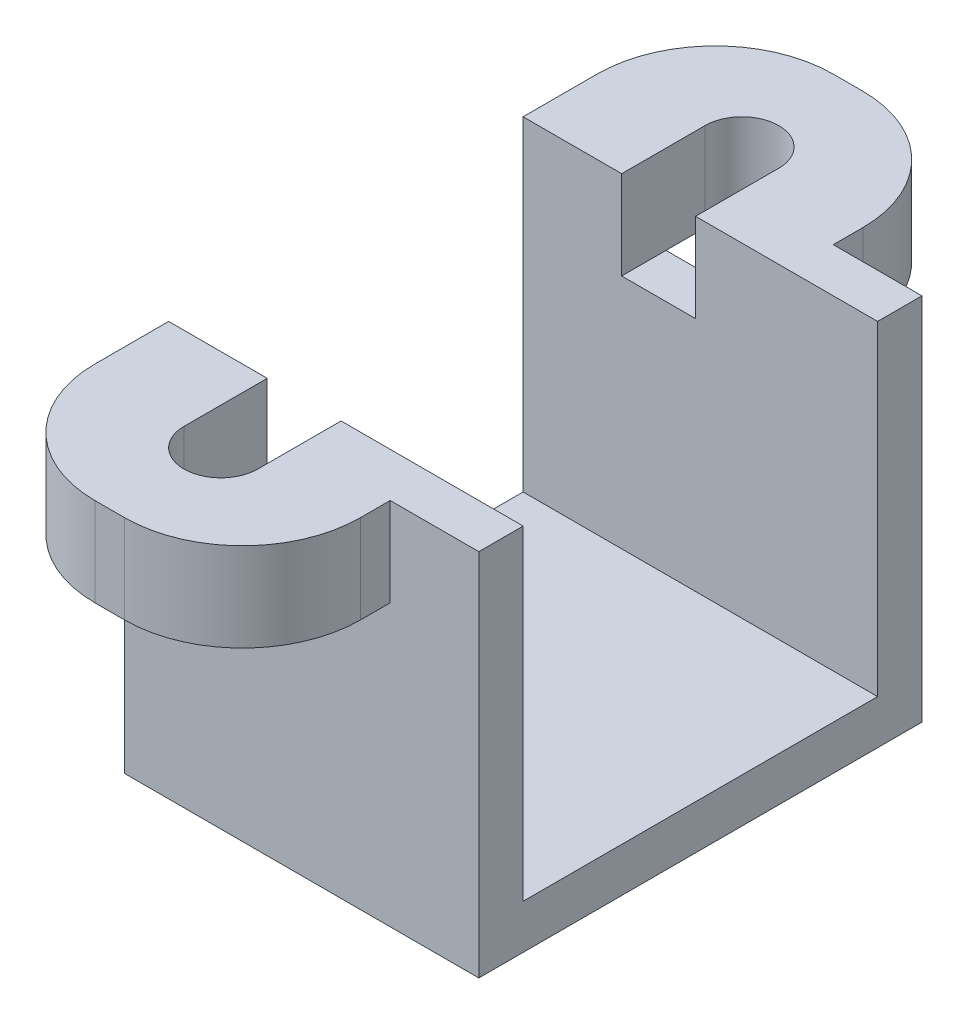
from build123d import *

# Parameters (mm, degrees)
SKETCH_1_W               = 12
SKETCH_1_H               = 15
EXTRUDE_1_DEPTH          = 1.5
SKETCH_2_W               = 12
SKETCH_2_H               = 1.5
EXTRUDE_2_DEPTH          = 11
SKETCH_3_W               = 9
SKETCH_3_H               = 6.5
EXTRUDE_3_DEPTH          = 3
FILLET_1_R               = 4
CUT_EXTRUDE_1_DEPTH      = 19.668154703
CUT_EXTRUDE_1_DEPTH_BACK = 3
FILLET_2_R               = 4


with BuildPart() as part:
    # 草图1 → 凸台-拉伸1 (new body)
    with BuildSketch(Plane(origin=(0, 0, 0), x_dir=(1, 0, 0), z_dir=(0, 1, 0))):
        Rectangle(SKETCH_1_W, SKETCH_1_H)
    extrude(amount=EXTRUDE_1_DEPTH)

    # 草图2 → 凸台-拉伸2 (add)
    with BuildSketch(Plane(origin=(0, 1.5, 0), x_dir=(1, 0, 0), z_dir=(0, 1, 0))):
        with Locations((0, 6.75)):
            Rectangle(SKETCH_2_W, SKETCH_2_H)
        with Locations((0, -6.75)):
            Rectangle(SKETCH_2_W, SKETCH_2_H)
    extrude(amount=EXTRUDE_2_DEPTH)

    # 草图3 → 凸台-拉伸3 (add)
    with BuildSketch(Plane(origin=(0, 12.5, 0), x_dir=(1, 0, 0), z_dir=(0, 1, 0))):
        with Locations((-1.5, 9.25)):
            Rectangle(SKETCH_3_W, SKETCH_3_H)
        with Locations((-1.5, -9.25)):
            Rectangle(SKETCH_3_W, SKETCH_3_H)
    extrude(amount=-EXTRUDE_3_DEPTH)

    # 圆角1
    fillet_1_edges = [part.edges().sort_by_distance(p)[0] for p in [
        (3, 11, -12.5),
        (-6, 11, -12.5),
    ]]
    fillet(fillet_1_edges, radius=FILLET_1_R)

    # 草图4 → 切除-拉伸1 (cut, two sides: drawn at the far end of the back side and taken through both)
    with BuildSketch(Plane(origin=(0, 12.5, 0), x_dir=(1, 0, 0), z_dir=(0, 1, 0)).offset(-CUT_EXTRUDE_1_DEPTH_BACK)):
        with BuildLine():
            Line((-2.66316567, 8.819250258), (-2.66316567, 6))
            Line((-2.66316567, 6), (-0.16316567, 6))
            Line((-0.16316567, 6), (-0.16316567, 8.819250258))
            ThreePointArc((-0.16316567, 8.819250258), (-1.41316567, 10.069250258), (-2.66316567, 8.819250258))
        make_face()
        with BuildLine():
            Line((-0.16316567, -6), (-0.16316567, -8.819250258))
            ThreePointArc((-0.16316567, -8.819250258), (-1.41316567, -10.069250258), (-2.66316567, -8.819250258))
            Line((-2.66316567, -8.819250258), (-2.66316567, -6))
            Line((-2.66316567, -6), (-0.16316567, -6))
        make_face()
    extrude(amount=CUT_EXTRUDE_1_DEPTH + CUT_EXTRUDE_1_DEPTH_BACK, mode=Mode.SUBTRACT)

    # 圆角2
    fillet_2_edges = [part.edges().sort_by_distance(p)[0] for p in [
        (-6, 11, 12.5),
        (3, 11, 12.5),
    ]]
    fillet(fillet_2_edges, radius=FILLET_2_R)


solid = part.part
